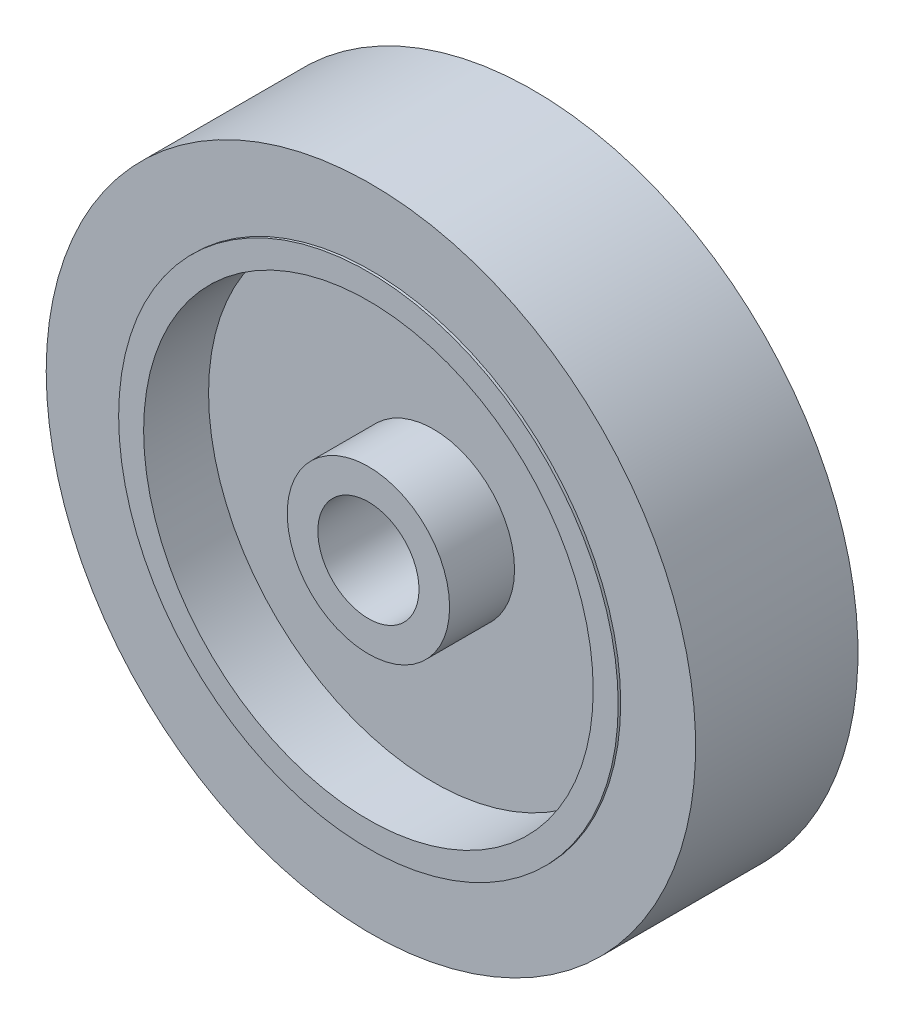
from build123d import *

# Parameters (mm, degrees)
CROQUIS1_R                          = 26
SALIENTE_EXTRUIR1_DEPTH             = 6.5
CROQUIS2_R                          = 20
CROQUIS2_R_2                        = 18
SALIENTE_EXTRUIR3_DEPTH             = 0.2
SALIENTE_EXTRUIR4_START             = 0.2
CROQUIS4_R                          = 20
CROQUIS4_R_2                        = 18
SALIENTE_EXTRUIR4_DEPTH             = 0.2
CROQUIS5_R                          = 18
CORTAR_EXTRUIR1_DEPTH               = 5
CORTAR_EXTRUIR2_START               = -5
CROQUIS6_R                          = 18
CORTAR_EXTRUIR2_DEPTH               = 5
SALIENTE_EXTRUIR5_REACH             = 39.673
CROQUIS7_R                          = 6.5
CROQUIS7_R_2                        = 4.05
SALIENTE_EXTRUIR5_DIRECTION_2_REACH = 39.673
CROQUIS8_R                          = 4.05
CORTAR_EXTRUIR3_DEPTH               = 39


with BuildPart() as part:
    # Croquis1 → Saliente-Extruir1 (new, symmetric)
    with BuildSketch(Plane.XY):
        with Locations(Location((0, 0, 0), (0, 0, 180))):
            Circle(CROQUIS1_R)
    extrude(amount=SALIENTE_EXTRUIR1_DEPTH, both=True)

    # Croquis2 → Saliente-Extruir3 (add)
    with BuildSketch(Plane.XY.offset(6.5)):
        Circle(CROQUIS2_R)
        Circle(CROQUIS2_R_2, mode=Mode.SUBTRACT)
    extrude(amount=SALIENTE_EXTRUIR3_DEPTH)

    # Croquis4 → Saliente-Extruir4 (add)
    with BuildSketch(Plane(origin=(0, 0, -6.5), x_dir=(-1, 0, 0), z_dir=(0, 0, -1)).offset(SALIENTE_EXTRUIR4_START)):
        with Locations(Location((0, 0, 0), (0, 0, 180))):
            Circle(CROQUIS4_R)
        with Locations(Location((0, 0, 0), (0, 0, 180))):
            Circle(CROQUIS4_R_2, mode=Mode.SUBTRACT)
    extrude(amount=-SALIENTE_EXTRUIR4_DEPTH)

    # Croquis5 → Cortar-Extruir1 (cut)
    with BuildSketch(Plane(origin=(0, 0, -6.5), x_dir=(-1, 0, 0), z_dir=(0, 0, -1))):
        with Locations(Location((0, 0, 0), (0, 0, 180))):
            Circle(CROQUIS5_R)
    extrude(amount=-CORTAR_EXTRUIR1_DEPTH, mode=Mode.SUBTRACT)

    # Croquis6 → Cortar-Extruir2 (cut)
    with BuildSketch(Plane.XY.offset(6.5).offset(CORTAR_EXTRUIR2_START)):
        Circle(CROQUIS6_R)
    extrude(amount=CORTAR_EXTRUIR2_DEPTH, mode=Mode.SUBTRACT)

    # Saliente-Extruir5: up to this face of the body (flat: up to its plane)
    saliente_extruir5_end = Plane(part.part.faces().sort_by_distance((-19.434314575, 0, -6.7))[0])
    # Croquis7 → Saliente-Extruir5 (add, up to the picked face)
    with BuildSketch(Plane(origin=(0, 0, -1.5), x_dir=(-1, 0, 0), z_dir=(0, 0, -1)), mode=Mode.PRIVATE) as saliente_extruir5_sk1:
        with Locations(Location((0, 0, 0), (0, 0, 180))):
            Circle(CROQUIS7_R)
        with Locations(Location((0, 0, 0), (0, 0, 180))):
            Circle(CROQUIS7_R_2, mode=Mode.SUBTRACT)
    saliente_extruir5_tool1 = split(extrude(saliente_extruir5_sk1.sketch, amount=SALIENTE_EXTRUIR5_REACH, mode=Mode.PRIVATE), bisect_by=saliente_extruir5_end, keep=Keep.BOTH, mode=Mode.PRIVATE)
    add(saliente_extruir5_tool1.solids().sort_by(Axis((-6.316152, 0, -1.5), (0, 0, -1)))[0])

    # Saliente-Extruir5 direction 2: up to this face of the body (flat: up to its plane)
    saliente_extruir5_direction_2_end = Plane(part.part.faces().sort_by_distance((-19.434314575, 0, 6.7))[0])
    # Croquis7 → Saliente-Extruir5 direction 2 (add, up to the picked face)
    with BuildSketch(Plane(origin=(0, 0, -1.5), x_dir=(-1, 0, 0), z_dir=(0, 0, -1)), mode=Mode.PRIVATE) as saliente_extruir5_direction_2_sk1:
        with Locations(Location((0, 0, 0), (0, 0, 180))):
            Circle(CROQUIS7_R)
        with Locations(Location((0, 0, 0), (0, 0, 180))):
            Circle(CROQUIS7_R_2, mode=Mode.SUBTRACT)
    saliente_extruir5_direction_2_tool1 = split(extrude(saliente_extruir5_direction_2_sk1.sketch, amount=-SALIENTE_EXTRUIR5_DIRECTION_2_REACH, mode=Mode.PRIVATE), bisect_by=saliente_extruir5_direction_2_end, keep=Keep.BOTH, mode=Mode.PRIVATE)
    add(saliente_extruir5_direction_2_tool1.solids().sort_by(Axis((-6.316152, 0, -1.5), (0, 0, 1)))[0])

    # Croquis8 → Cortar-Extruir3 (cut, symmetric)
    with BuildSketch(Plane(origin=(0, 0, -1.5), x_dir=(-1, 0, 0), z_dir=(0, 0, -1))):
        with Locations(Location((0, 0, 0), (0, 0, 180))):
            Circle(CROQUIS8_R)
    extrude(amount=CORTAR_EXTRUIR3_DEPTH, both=True, mode=Mode.SUBTRACT)


solid = part.part
